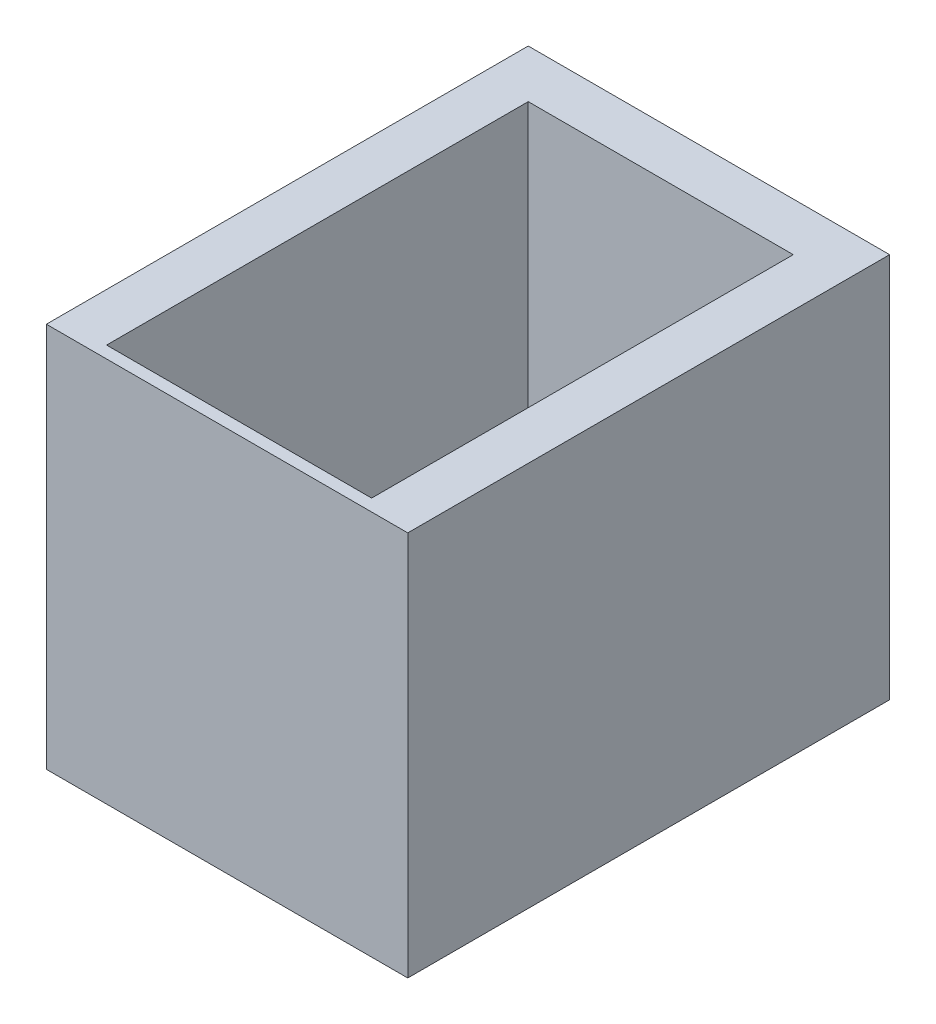
from build123d import *

# Parameters (mm, degrees)
SKETCH3_W           = 19.05
SKETCH3_H           = 25.4
BOSS_EXTRUDE1_DEPTH = 20.32
SKETCH4_W           = 13.97
SKETCH4_H           = 20.32
CUT_EXTRUDE1_DEPTH  = 17.78
CUT_EXTRUDE3_START  = -2.54
CUT_EXTRUDE3_DEPTH  = 13.97


with BuildPart() as part:
    # Sketch3 → Boss-Extrude1 (new body)
    with BuildSketch(Plane(origin=(0, 0, 0), x_dir=(1, 0, 0), z_dir=(0, 1, 0))):
        with Locations((9.525, 12.7)):
            Rectangle(SKETCH3_W, SKETCH3_H)
    extrude(amount=BOSS_EXTRUDE1_DEPTH)

    # Sketch4 → Cut-Extrude1 (cut)
    with BuildSketch(Plane(origin=(0, 20.32, 0), x_dir=(1, 0, 0), z_dir=(0, 1, 0))):
        with Locations((9.525, 12.7)):
            Rectangle(SKETCH4_W, SKETCH4_H)
    extrude(amount=-CUT_EXTRUDE1_DEPTH, mode=Mode.SUBTRACT)

    # Sketch6 → Cut-Extrude3 (cut)
    with BuildSketch(Plane.ZY.offset(CUT_EXTRUDE3_START)):
        Polygon((-2.562657446, 20.32), (-0.635, 20.32), (-2.562657446, 12.678976029), align=None)
    extrude(amount=-CUT_EXTRUDE3_DEPTH, mode=Mode.SUBTRACT)


solid = part.part
